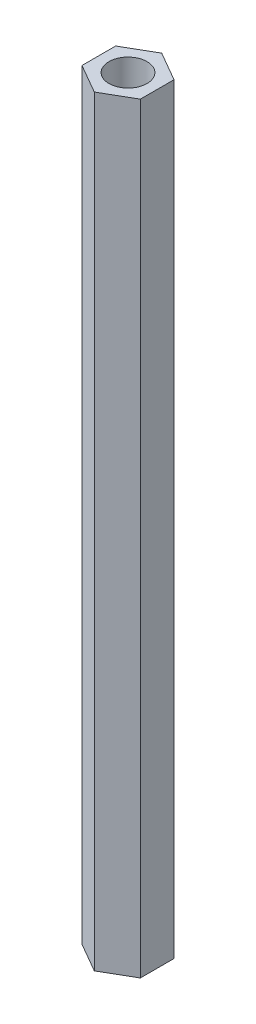
from build123d import *

# Parameters (mm, degrees)
SKETCH_1_R      = 1.5
EXTRUDE_1_DEPTH = 60


with BuildPart() as part:
    # 草图1 → 凸台-拉伸1 (new body)
    with BuildSketch(Plane(origin=(0, 0, 0), x_dir=(1, 0, 0), z_dir=(0, 1, 0))):
        Polygon((0, 2.655811238), (-2.3, 1.327905619), (-2.3, -1.327905619), (0, -2.655811238), (2.3, -1.327905619), (2.3, 1.327905619), align=None)
        with Locations(Location((0, 0, 0), (0, 0, 270))):
            Circle(SKETCH_1_R, mode=Mode.SUBTRACT)
    extrude(amount=EXTRUDE_1_DEPTH)


solid = part.part
